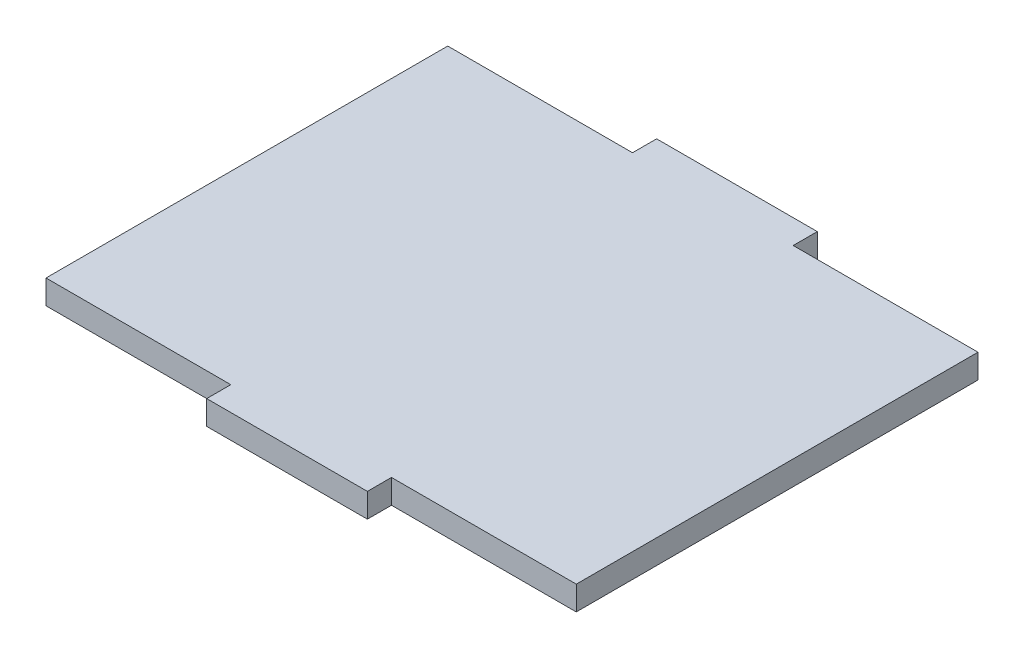
from build123d import *

# Parameters (mm, degrees)
BOSS_EXTRUDE1_DEPTH = 3


with BuildPart() as part:
    # Sketch1 → Boss-Extrude1 (new body)
    with BuildSketch(Plane(origin=(0, 0, 0), x_dir=(1, 0, 0), z_dir=(0, 1, 0))):
        Polygon((0, 0), (23, 0), (23, -3), (43, -3), (43, 0), (66, 0), (66, 50), (43, 50), (43, 53), (23, 53), (23, 50), (0, 50), align=None)
    extrude(amount=BOSS_EXTRUDE1_DEPTH)


solid = part.part
